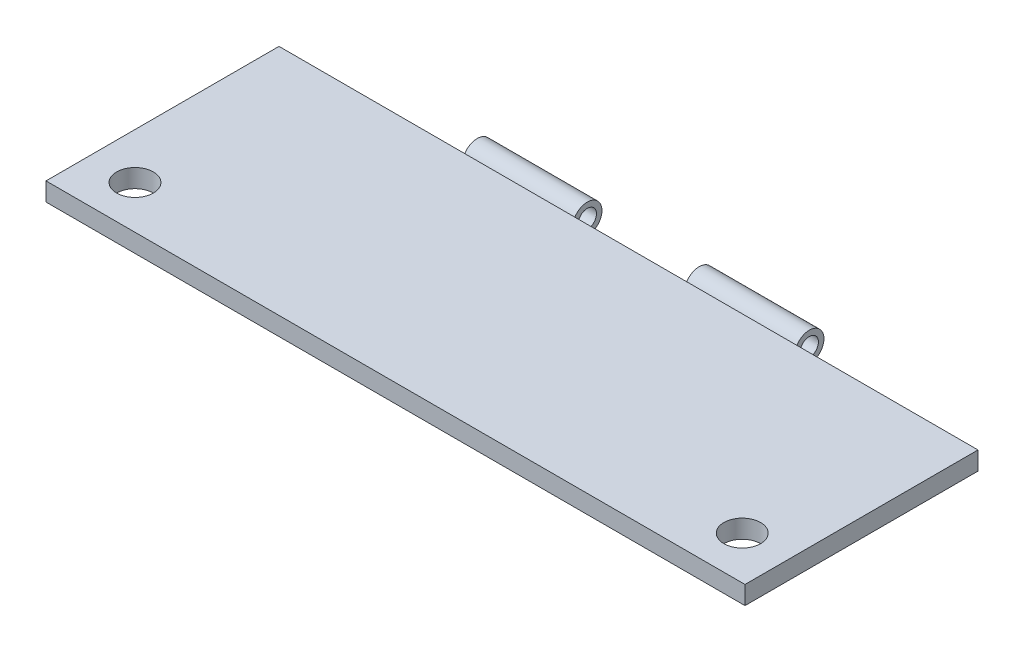
from build123d import *

# Parameters (mm, degrees)
CROQUIS1_W                        = 76.2
CROQUIS1_H                        = 25.4
SALIENTE_EXTRUIR1_DEPTH           = 2
CROQUIS2_R                        = 1.6
SALIENTE_EXTRUIR2_DEPTH           = 76.2
CROQUIS3_R                        = 2
CORTAR_EXTRUIR1_DEPTH             = 2
CROQUIS4_R                        = 1
CORTAR_EXTRUIR2_DEPTH             = 76.2
CORTAR_EXTRUIR5_REACH             = 43.375
CROQUIS5_W                        = 20
CROQUIS5_H                        = 3.21236059
CROQUIS5_H_2                      = 3.2
CROQUIS5_W_2                      = 12.2
CORTAR_EXTRUIR5_DIRECTION_2_REACH = 43.375


with BuildPart() as part:
    # Croquis1 → Saliente-Extruir1 (new body)
    with BuildSketch(Plane(origin=(0, 0, 0), x_dir=(1, 0, 0), z_dir=(0, 1, 0))):
        Rectangle(CROQUIS1_W, CROQUIS1_H)
    extrude(amount=SALIENTE_EXTRUIR1_DEPTH)

    # Croquis3 → Cortar-Extruir1 (cut)
    with BuildSketch(Plane(origin=(0, 2, 0), x_dir=(1, 0, 0), z_dir=(0, 1, 0))):
        with Locations(Location((-33.1, -8, 0), (0, 0, 270))):
            Circle(CROQUIS3_R)
        with Locations(Location((33.1, -8, 0), (0, 0, 270))):
            Circle(CROQUIS3_R)
    extrude(amount=-CORTAR_EXTRUIR1_DEPTH, mode=Mode.SUBTRACT)


with BuildPart() as body_2:
    # Croquis2 → Saliente-Extruir2 (new body)
    with BuildSketch(Plane.ZY.offset(38.1)):
        with Locations((-14.306180295, 0.901009784)):
            Circle(CROQUIS2_R)
    extrude(amount=-SALIENTE_EXTRUIR2_DEPTH)

    # Croquis4 → Cortar-Extruir2 (cut)
    with BuildSketch(Plane.ZY.offset(38.1)):
        with Locations((-14.306180295, 0.901009784)):
            Circle(CROQUIS4_R)
    extrude(amount=-CORTAR_EXTRUIR2_DEPTH, mode=Mode.SUBTRACT)

    # Croquis5 → Cortar-Extruir5 (cut, up to next)
    with BuildSketch(Plane(origin=(0, 2, 0), x_dir=(1, 0, 0), z_dir=(0, 1, 0)), mode=Mode.PRIVATE) as cortar_extruir5_sk1:
        with Locations((-28.1, 14.306180295)):
            Rectangle(CROQUIS5_W, CROQUIS5_H)
    cortar_extruir5_tool1 = extrude(cortar_extruir5_sk1.sketch, amount=-CORTAR_EXTRUIR5_REACH, mode=Mode.PRIVATE) & body_2.part
    # Croquis5 → Cortar-Extruir5 (cut, up to next)
    with BuildSketch(Plane(origin=(0, 2, 0), x_dir=(1, 0, 0), z_dir=(0, 1, 0)), mode=Mode.PRIVATE) as cortar_extruir5_sk2:
        with Locations((28.1, 14.306180295)):
            Rectangle(CROQUIS5_W, CROQUIS5_H_2)
    cortar_extruir5_tool2 = extrude(cortar_extruir5_sk2.sketch, amount=-CORTAR_EXTRUIR5_REACH, mode=Mode.PRIVATE) & body_2.part
    # Croquis5 → Cortar-Extruir5 (cut, up to next)
    with BuildSketch(Plane(origin=(0, 2, 0), x_dir=(1, 0, 0), z_dir=(0, 1, 0)), mode=Mode.PRIVATE) as cortar_extruir5_sk3:
        with Locations((0, 14.306180295)):
            Rectangle(CROQUIS5_W_2, CROQUIS5_H_2)
    cortar_extruir5_tool3 = extrude(cortar_extruir5_sk3.sketch, amount=-CORTAR_EXTRUIR5_REACH, mode=Mode.PRIVATE) & body_2.part
    add(cortar_extruir5_tool1.solids().sort_by_distance((-28.1, 2, -14.30618))[0], mode=Mode.SUBTRACT)
    add(cortar_extruir5_tool2.solids().sort_by_distance((28.1, 2, -14.30618))[0], mode=Mode.SUBTRACT)
    add(cortar_extruir5_tool3.solids().sort_by_distance((0, 2, -14.30618))[0], mode=Mode.SUBTRACT)

    # Croquis5 → Cortar-Extruir5 direction 2 (cut, up to next)
    with BuildSketch(Plane(origin=(0, 2, 0), x_dir=(1, 0, 0), z_dir=(0, 1, 0)), mode=Mode.PRIVATE) as cortar_extruir5_direction_2_sk1:
        with Locations((-28.1, 14.306180295)):
            Rectangle(CROQUIS5_W, CROQUIS5_H)
    cortar_extruir5_direction_2_tool1 = extrude(cortar_extruir5_direction_2_sk1.sketch, amount=CORTAR_EXTRUIR5_DIRECTION_2_REACH, mode=Mode.PRIVATE) & body_2.part
    # Croquis5 → Cortar-Extruir5 direction 2 (cut, up to next)
    with BuildSketch(Plane(origin=(0, 2, 0), x_dir=(1, 0, 0), z_dir=(0, 1, 0)), mode=Mode.PRIVATE) as cortar_extruir5_direction_2_sk2:
        with Locations((28.1, 14.306180295)):
            Rectangle(CROQUIS5_W, CROQUIS5_H_2)
    cortar_extruir5_direction_2_tool2 = extrude(cortar_extruir5_direction_2_sk2.sketch, amount=CORTAR_EXTRUIR5_DIRECTION_2_REACH, mode=Mode.PRIVATE) & body_2.part
    # Croquis5 → Cortar-Extruir5 direction 2 (cut, up to next)
    with BuildSketch(Plane(origin=(0, 2, 0), x_dir=(1, 0, 0), z_dir=(0, 1, 0)), mode=Mode.PRIVATE) as cortar_extruir5_direction_2_sk3:
        with Locations((0, 14.306180295)):
            Rectangle(CROQUIS5_W_2, CROQUIS5_H_2)
    cortar_extruir5_direction_2_tool3 = extrude(cortar_extruir5_direction_2_sk3.sketch, amount=CORTAR_EXTRUIR5_DIRECTION_2_REACH, mode=Mode.PRIVATE) & body_2.part
    add(cortar_extruir5_direction_2_tool1.solids().sort_by_distance((-28.1, 2, -14.30618))[0], mode=Mode.SUBTRACT)
    add(cortar_extruir5_direction_2_tool2.solids().sort_by_distance((28.1, 2, -14.30618))[0], mode=Mode.SUBTRACT)
    add(cortar_extruir5_direction_2_tool3.solids().sort_by_distance((0, 2, -14.30618))[0], mode=Mode.SUBTRACT)


with BuildPart() as cortar_extruir5_piece_1:
    # of the separate pieces the step leaves, piece 1, a body of its own (cortar_extruir5_pieces)
    add(body_2.part.solids().sort_by_distance((6.1, 0.901009784, -12.706180295))[0])


with BuildPart() as cortar_extruir5_piece_2:
    # of the separate pieces the step leaves, piece 2, a body of its own (cortar_extruir5_pieces)
    add(body_2.part.solids().sort_by_distance((-18.1, 0.901009784, -12.706180295))[0])


solid = Compound([part.part, cortar_extruir5_piece_1.part, cortar_extruir5_piece_2.part])
